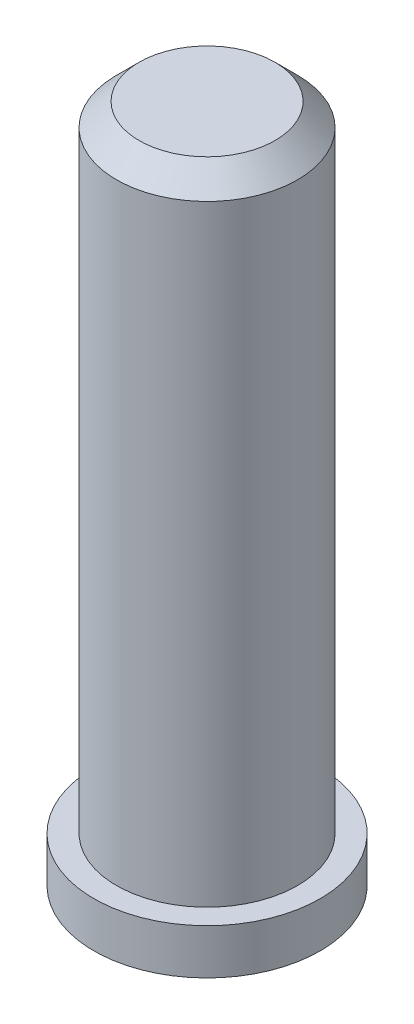
from build123d import *

# Parameters (mm, degrees)
SKETCH1_W     = 4
SKETCH1_H     = 28
CHAMFER1_SIZE = 1


with BuildPart() as part:
    # Sketch1 → Revolve1 (revolve)
    with BuildSketch(Plane(origin=(0, 0, 0), x_dir=(0, 0, -1), z_dir=(1, 0, 0))):
        with Locations((2, 15)):
            Rectangle(SKETCH1_W, SKETCH1_H)
        Polygon((0, 1), (0, -1), (5, -1), (5, 1), (4, 1), align=None)
    revolve(axis=Axis((0, -1, 0), (0, 1, 0)))

    # Chamfer1
    chamfer1_edges = [part.edges().sort_by_distance(p)[0] for p in [
        (0, 29, 4),
    ]]
    chamfer(chamfer1_edges, length=CHAMFER1_SIZE)


solid = part.part
